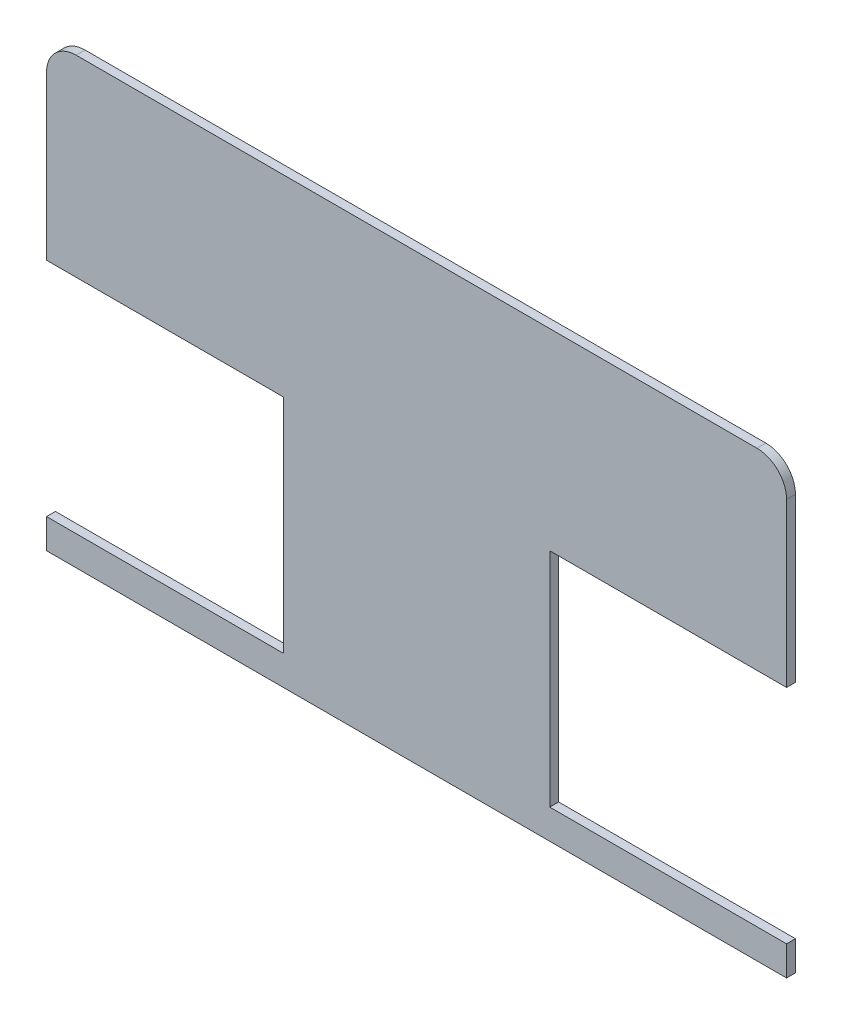
from build123d import *

# Parameters (mm, degrees)
BOSS_EXTRUDE1_DEPTH = 3


with BuildPart() as part:
    # Sketch1 → Boss-Extrude1 (new body)
    with BuildSketch(Plane.XY):
        with BuildLine():
            Line((10, 0), (240, 0))
            ThreePointArc((240, 0), (247.071067812, -2.928932188), (250, -10))
            Line((250, -10), (250, -65))
            Line((250, -65), (170, -65))
            Line((170, -65), (170, -140))
            Line((170, -140), (250, -140))
            Line((250, -140), (250, -150))
            Line((250, -150), (0, -150))
            Line((0, -150), (0, -140))
            Line((0, -140), (80, -140))
            Line((80, -140), (80, -65))
            Line((80, -65), (0, -65))
            Line((0, -65), (0, -10))
            ThreePointArc((0, -10), (2.928932188, -2.928932188), (10, 0))
        make_face()
    extrude(amount=BOSS_EXTRUDE1_DEPTH)


solid = part.part
